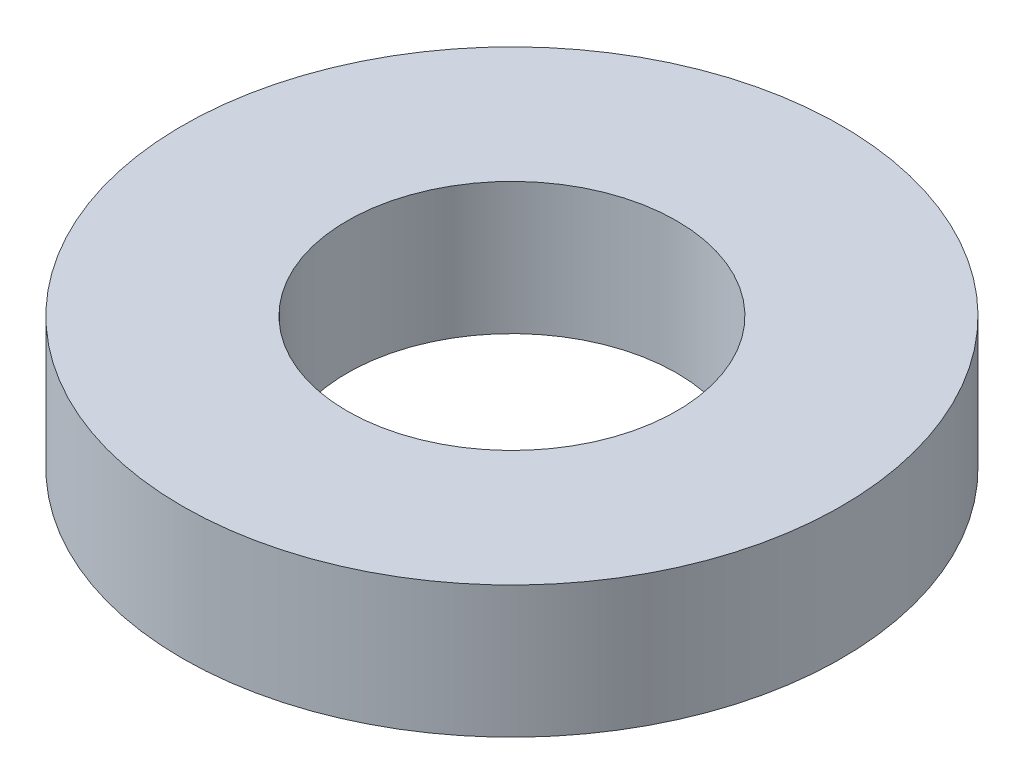
from build123d import *

# Parameters (mm, degrees)
SKETCH_1_R      = 50
SKETCH_1_R_2    = 25
EXTRUDE_1_DEPTH = 10


with BuildPart() as part:
    # 草图1 → 凸台-拉伸1 (new, symmetric)
    with BuildSketch(Plane(origin=(0, 0, 0), x_dir=(1, 0, 0), z_dir=(0, 1, 0))):
        with Locations(Location((0, 0, 0), (0, 0, 270))):
            Circle(SKETCH_1_R)
        with Locations(Location((0, 0, 0), (0, 0, 270))):
            Circle(SKETCH_1_R_2, mode=Mode.SUBTRACT)
    extrude(amount=EXTRUDE_1_DEPTH, both=True)


solid = part.part
